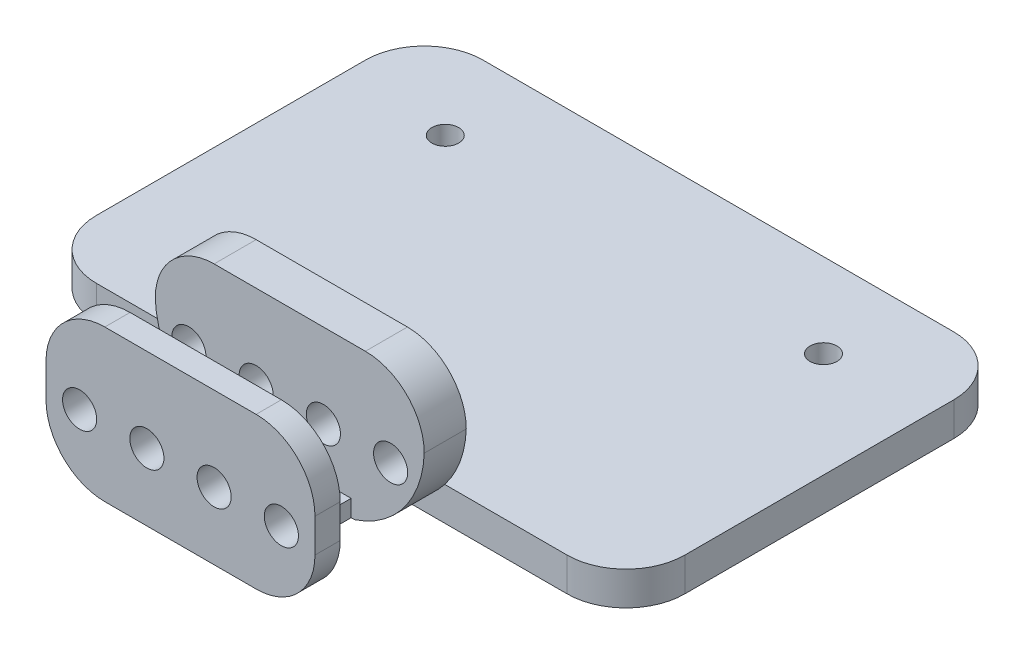
from build123d import *

# Parameters (mm, degrees)
SKETCH_1_W          = 70
SKETCH_1_H          = 46
EXTRUDE_1_DEPTH     = 4
CUT_EXTRUDE_1_REACH = 44.071
SKETCH_2_R          = 1.6
SKETCH_3_W          = 32
SKETCH_3_H          = 18
EXTRUDE_2_DEPTH     = 5
SKETCH_4_W          = 15
SKETCH_4_H          = 2
EXTRUDE_3_DEPTH     = 10
SKETCH_5_W          = 32
SKETCH_5_H          = 18
EXTRUDE_4_DEPTH     = 3
CUT_EXTRUDE_2_REACH = 77.133
SKETCH_6_R          = 2.03
FILLET_2_R          = 7
CUT_EXTRUDE_3_DEPTH = 5


with BuildPart() as part:
    # 草图1 → 凸台-拉伸1 (new body)
    with BuildSketch(Plane(origin=(0, 0, 0), x_dir=(1, 0, 0), z_dir=(0, 1, 0))):
        Rectangle(SKETCH_1_W, SKETCH_1_H)
    extrude(amount=EXTRUDE_1_DEPTH)

    # 草图2 → 切除-拉伸1 (cut, up to next)
    with BuildSketch(Plane(origin=(0, 4, 0), x_dir=(1, 0, 0), z_dir=(0, 1, 0)), mode=Mode.PRIVATE) as cut_extrude_1_sk1:
        with Locations(Location((-22.5, 13, 0), (0, 0, 270))):
            Circle(SKETCH_2_R)
    cut_extrude_1_tool1 = extrude(cut_extrude_1_sk1.sketch, amount=-CUT_EXTRUDE_1_REACH, mode=Mode.PRIVATE) & part.part
    # 草图2 → 切除-拉伸1 (cut, up to next)
    with BuildSketch(Plane(origin=(0, 4, 0), x_dir=(1, 0, 0), z_dir=(0, 1, 0)), mode=Mode.PRIVATE) as cut_extrude_1_sk2:
        with Locations(Location((22.5, 13, 0), (0, 0, 270))):
            Circle(SKETCH_2_R)
    cut_extrude_1_tool2 = extrude(cut_extrude_1_sk2.sketch, amount=-CUT_EXTRUDE_1_REACH, mode=Mode.PRIVATE) & part.part
    add(cut_extrude_1_tool1.solids().sort_by_distance((-22.5, 4, -13))[0], mode=Mode.SUBTRACT)
    add(cut_extrude_1_tool2.solids().sort_by_distance((22.5, 4, -13))[0], mode=Mode.SUBTRACT)

    # 草图3 → 凸台-拉伸2 (add)
    with BuildSketch(Plane.XY.offset(23)):
        with Locations((0, 9)):
            Rectangle(SKETCH_3_W, SKETCH_3_H)
    extrude(amount=EXTRUDE_2_DEPTH)

    # 草图4 → 凸台-拉伸3 (add)
    with BuildSketch(Plane.XY.offset(28)):
        with Locations((-0.197819001, 1)):
            Rectangle(SKETCH_4_W, SKETCH_4_H)
    extrude(amount=EXTRUDE_3_DEPTH)

    # 草图5 → 凸台-拉伸4 (add)
    with BuildSketch(Plane.XY.offset(38)):
        with Locations((0, 9)):
            Rectangle(SKETCH_5_W, SKETCH_5_H)
    extrude(amount=EXTRUDE_4_DEPTH)

    # 切除-拉伸2: up to this face of the body (flat: up to its plane)
    cut_extrude_2_end = Plane(part.part.faces().sort_by_distance((0, 11, 23))[0])
    # 草图6 → 切除-拉伸2 (cut, up to the picked face)
    with BuildSketch(Plane.XY.offset(41), mode=Mode.PRIVATE) as cut_extrude_2_sk1:
        with Locations((-12, 8)):
            Circle(SKETCH_6_R)
    cut_extrude_2_tool1 = split(extrude(cut_extrude_2_sk1.sketch, amount=-CUT_EXTRUDE_2_REACH, mode=Mode.PRIVATE), bisect_by=cut_extrude_2_end, keep=Keep.BOTH, mode=Mode.PRIVATE)
    # 草图6 → 切除-拉伸2 (cut, up to the picked face)
    with BuildSketch(Plane.XY.offset(41), mode=Mode.PRIVATE) as cut_extrude_2_sk2:
        with Locations((-4, 8)):
            Circle(SKETCH_6_R)
    cut_extrude_2_tool2 = split(extrude(cut_extrude_2_sk2.sketch, amount=-CUT_EXTRUDE_2_REACH, mode=Mode.PRIVATE), bisect_by=cut_extrude_2_end, keep=Keep.BOTH, mode=Mode.PRIVATE)
    # 草图6 → 切除-拉伸2 (cut, up to the picked face)
    with BuildSketch(Plane.XY.offset(41), mode=Mode.PRIVATE) as cut_extrude_2_sk3:
        with Locations((4, 8)):
            Circle(SKETCH_6_R)
    cut_extrude_2_tool3 = split(extrude(cut_extrude_2_sk3.sketch, amount=-CUT_EXTRUDE_2_REACH, mode=Mode.PRIVATE), bisect_by=cut_extrude_2_end, keep=Keep.BOTH, mode=Mode.PRIVATE)
    # 草图6 → 切除-拉伸2 (cut, up to the picked face)
    with BuildSketch(Plane.XY.offset(41), mode=Mode.PRIVATE) as cut_extrude_2_sk4:
        with Locations((12, 8)):
            Circle(SKETCH_6_R)
    cut_extrude_2_tool4 = split(extrude(cut_extrude_2_sk4.sketch, amount=-CUT_EXTRUDE_2_REACH, mode=Mode.PRIVATE), bisect_by=cut_extrude_2_end, keep=Keep.BOTH, mode=Mode.PRIVATE)
    add(cut_extrude_2_tool1.solids().sort_by(Axis((-12, 8, 41), (0, 0, -1)))[0], mode=Mode.SUBTRACT)
    add(cut_extrude_2_tool2.solids().sort_by(Axis((-4, 8, 41), (0, 0, -1)))[0], mode=Mode.SUBTRACT)
    add(cut_extrude_2_tool3.solids().sort_by(Axis((4, 8, 41), (0, 0, -1)))[0], mode=Mode.SUBTRACT)
    add(cut_extrude_2_tool4.solids().sort_by(Axis((12, 8, 41), (0, 0, -1)))[0], mode=Mode.SUBTRACT)

    # 圆角2
    fillet_2_edges = [part.edges().sort_by_distance(p)[0] for p in [
        (-16, 18, 25.5),
        (16, 18, 25.5),
        (-16, 18, 39.5),
        (-16, 0, 39.5),
        (16, 0, 39.5),
        (16, 18, 39.5),
        (35, 2, 23),
        (-35, 2, 23),
        (-35, 2, -23),
        (35, 2, -23),
    ]]
    fillet(fillet_2_edges, radius=FILLET_2_R)

    # 草图10 → 切除-拉伸3 (cut)
    with BuildSketch(Plane.XY.offset(28)):
        with BuildLine():
            Line((-16, 11), (-16, 0))
            Line((-16, 0), (-7.697819001, 0))
            ThreePointArc((-7.697819001, 0), (-13.585443233, 4.189362059), (-16, 11))
        make_face()
        with BuildLine():
            Line((16, 0), (7.697819001, 0))
            ThreePointArc((7.697819001, 0), (13.585443233, 4.189362059), (16, 11))
            Line((16, 11), (16, 0))
        make_face()
    extrude(amount=-CUT_EXTRUDE_3_DEPTH, mode=Mode.SUBTRACT)


solid = part.part
